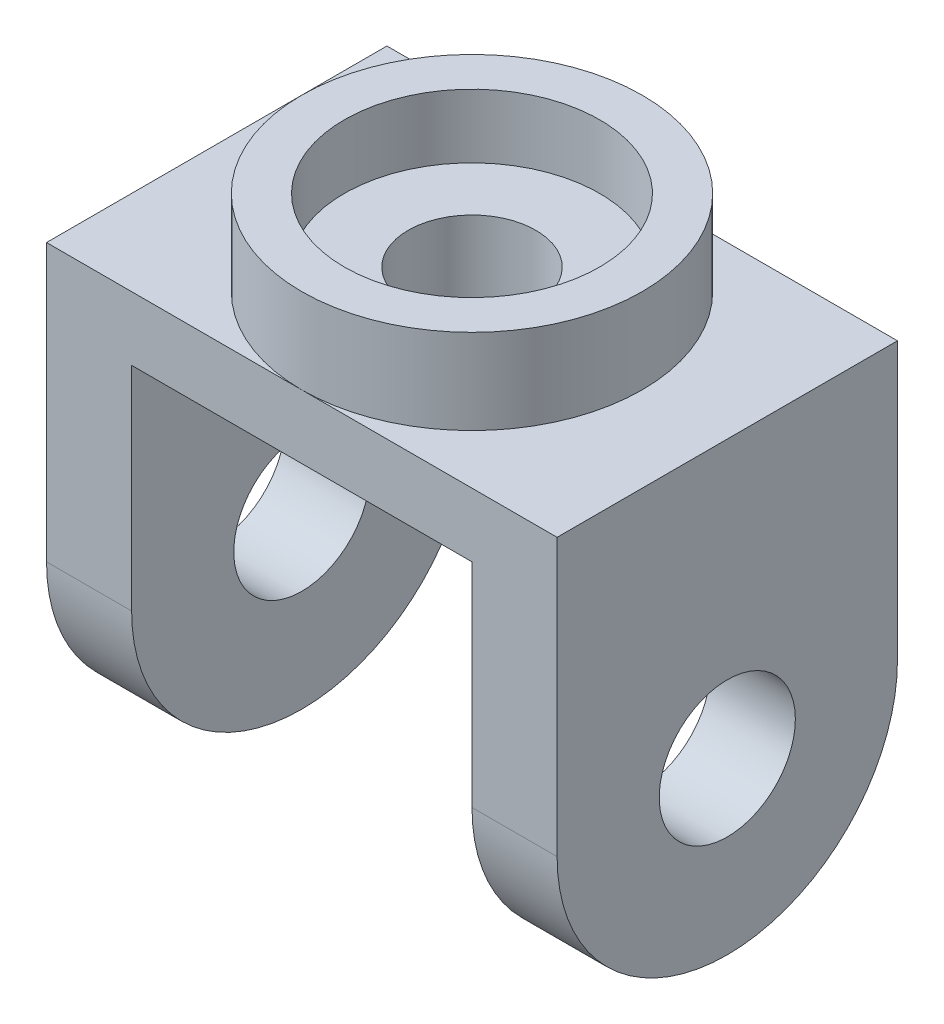
from build123d import *

# Parameters (mm, degrees)
SKETCH1_W           = 120
SKETCH1_H           = 80
BOSS_EXTRUDE1_DEPTH = 15
SKETCH2_R           = 40
BOSS_EXTRUDE2_DEPTH = 20
SKETCH3_R           = 30
CUT_EXTRUDE1_DEPTH  = 15
SKETCH4_R           = 15
CUT_EXTRUDE2_DEPTH  = 75.833147735
SKETCH5_R           = 16
BOSS_EXTRUDE3_DEPTH = 20


with BuildPart() as part:
    # Sketch1 → Boss-Extrude1 (new body)
    with BuildSketch(Plane(origin=(0, 0, 0), x_dir=(1, 0, 0), z_dir=(0, 1, 0))):
        Rectangle(SKETCH1_W, SKETCH1_H)
    extrude(amount=BOSS_EXTRUDE1_DEPTH)

    # Sketch2 → Boss-Extrude2 (add)
    with BuildSketch(Plane(origin=(0, 15, 0), x_dir=(1, 0, 0), z_dir=(0, 1, 0))):
        with Locations(Location((0, 0, 0), (0, 0, 270))):
            Circle(SKETCH2_R)
    extrude(amount=BOSS_EXTRUDE2_DEPTH)

    # Sketch3 → Cut-Extrude1 (cut)
    with BuildSketch(Plane(origin=(0, 35, 0), x_dir=(1, 0, 0), z_dir=(0, 1, 0))):
        with Locations(Location((0, 0, 0), (0, 0, 270))):
            Circle(SKETCH3_R)
    extrude(amount=-CUT_EXTRUDE1_DEPTH, mode=Mode.SUBTRACT)

    # Sketch4 → Cut-Extrude2 (cut, through all)
    with BuildSketch(Plane(origin=(0, 20, 0), x_dir=(1, 0, 0), z_dir=(0, 1, 0))):
        with Locations(Location((0, 0, 0), (0, 0, 270))):
            Circle(SKETCH4_R)
    extrude(amount=-CUT_EXTRUDE2_DEPTH, mode=Mode.SUBTRACT)

    # Sketch5 → Boss-Extrude3 (add)
    with BuildSketch(Plane(origin=(60, 0, 0), x_dir=(0, 0, -1), z_dir=(1, 0, 0))):
        with BuildLine():
            Line((40, -50), (40, 0))
            Line((40, 0), (-40, 0))
            Line((-40, 0), (-40, -50))
            ThreePointArc((-40, -50), (0, -90), (40, -50))
        make_face()
        with Locations((0, -50)):
            Circle(SKETCH5_R, mode=Mode.SUBTRACT)
    boss_extrude3 = extrude(amount=-BOSS_EXTRUDE3_DEPTH)

    # Mirror1: Boss-Extrude3 across plane
    add(boss_extrude3.mirror(Plane(origin=(0, 0, 0), x_dir=(0, 0, 1), z_dir=(1, 0, 0))))


solid = part.part
